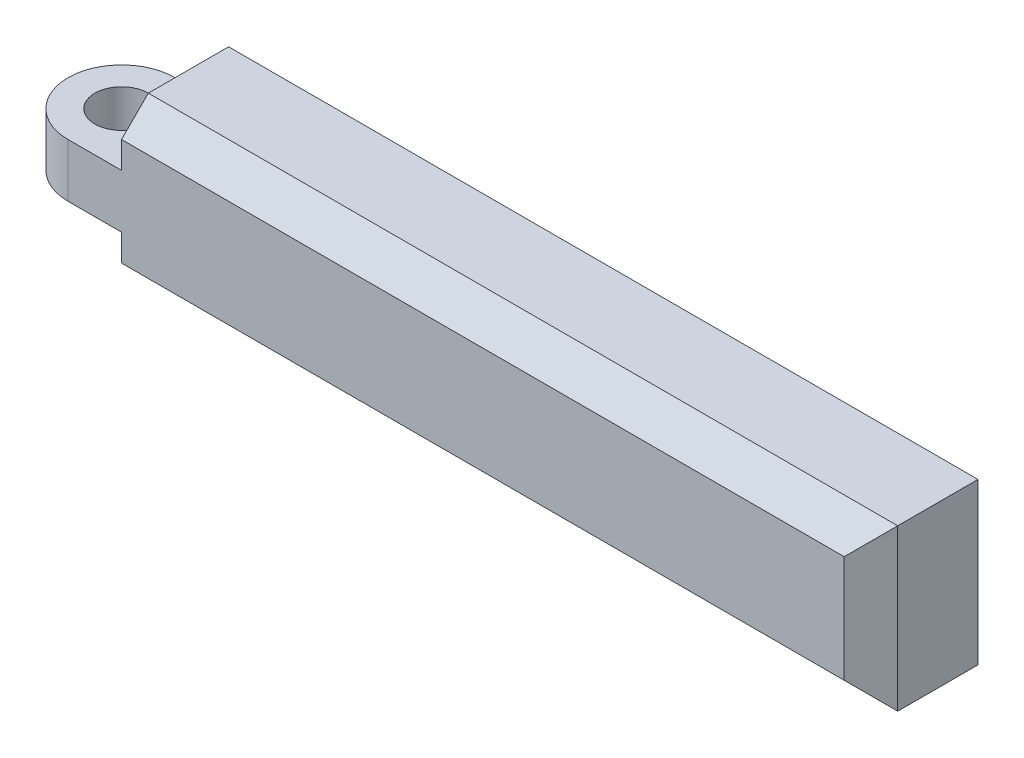
from build123d import *

# Parameters (mm, degrees)
SKETCH1_W           = 14
SKETCH1_H           = 2
BOSS_EXTRUDE1_DEPTH = 3
CHAMFER1_SIZE       = 0.5
SKETCH2_W           = 2
SKETCH2_H           = 1
BOSS_EXTRUDE2_DEPTH = 2
SKETCH3_R           = 0.5
CUT_EXTRUDE1_DEPTH  = 2


with BuildPart() as part:
    # Sketch1 → Boss-Extrude1 (new body)
    with BuildSketch(Plane(origin=(0, 0, 0), x_dir=(1, 0, 0), z_dir=(0, 1, 0))):
        Rectangle(SKETCH1_W, SKETCH1_H)
    extrude(amount=BOSS_EXTRUDE1_DEPTH)

    # Chamfer1
    chamfer1_edges = [part.edges().sort_by_distance(p)[0] for p in [
        (0, 0, -1),
        (7, 1.5, -1),
        (0, 3, -1),
    ]]
    chamfer(chamfer1_edges, length=CHAMFER1_SIZE)

    # Sketch2 → Boss-Extrude2 (add)
    with BuildSketch(Plane.ZY.offset(7)):
        with Locations((0, 1.5)):
            Rectangle(SKETCH2_W, SKETCH2_H)
    extrude(amount=BOSS_EXTRUDE2_DEPTH)

    # Sketch3 → Cut-Extrude1 (cut)
    with BuildSketch(Plane(origin=(0, 2, 0), x_dir=(1, 0, 0), z_dir=(0, 1, 0))):
        with Locations(Location((-8, 0, 0), (0, 0, 270))):
            Circle(SKETCH3_R)
        with BuildLine():
            ThreePointArc((-9, 0), (-8.707106781, 0.707106781), (-8, 1))
            Line((-8, 1), (-9, 1))
            Line((-9, 1), (-9, 0))
        make_face()
        with BuildLine():
            Line((-9, -1), (-8, -1))
            ThreePointArc((-8, -1), (-8.707106781, -0.707106781), (-9, 0))
            Line((-9, 0), (-9, -1))
        make_face()
    extrude(amount=-CUT_EXTRUDE1_DEPTH, mode=Mode.SUBTRACT)


with BuildPart() as body_2:
    # Mirror1: mirrored copy
    add(part.part.mirror(Plane(origin=(-7, 3, -1), x_dir=(1, 0, 0), z_dir=(0, 0, 1))))


solid = body_2.part
